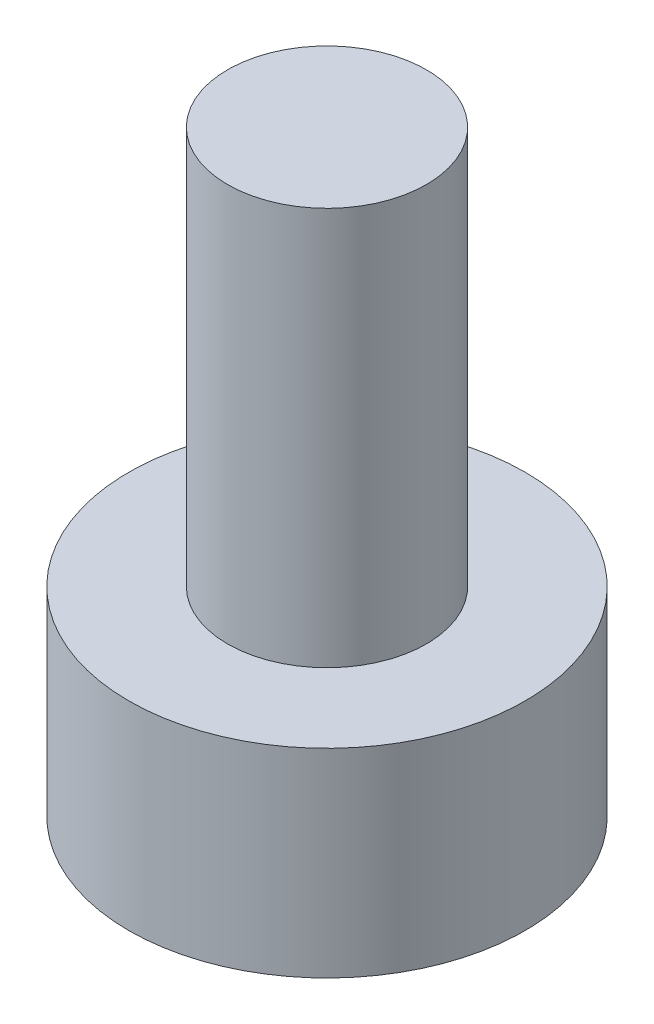
from build123d import *

# Parameters (mm, degrees)
SKETCH1_R           = 4.98
BOSS_EXTRUDE1_DEPTH = 5
SKETCH2_R           = 2.5
BOSS_EXTRUDE2_DEPTH = 10


with BuildPart() as part:
    # Sketch1 → Boss-Extrude1 (new body)
    with BuildSketch(Plane(origin=(0, 0, 0), x_dir=(1, 0, 0), z_dir=(0, 1, 0))):
        with Locations(Location((0, 0, 0), (0, 0, 270))):
            Circle(SKETCH1_R)
    extrude(amount=BOSS_EXTRUDE1_DEPTH)

    # Sketch2 → Boss-Extrude2 (add)
    with BuildSketch(Plane(origin=(0, 5, 0), x_dir=(1, 0, 0), z_dir=(0, 1, 0))):
        with Locations(Location((0, 0, 0), (0, 0, 270))):
            Circle(SKETCH2_R)
    extrude(amount=BOSS_EXTRUDE2_DEPTH)


solid = part.part
